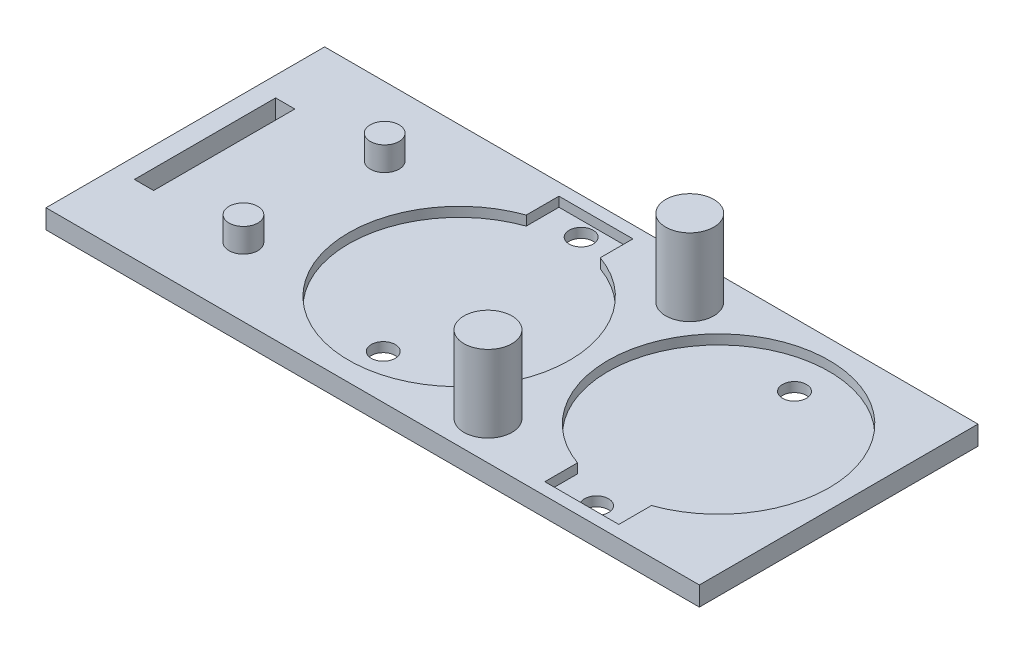
from build123d import *

# Parameters (mm, degrees)
SKETCH1_W             = 68
SKETCH1_H             = 29
BASE_DEPTH            = 2
SKETCH2_R             = 1.5
LEFT_PEG_DEPTH        = 2.5
SKETCH3_R             = 1.5
RIGHT_PEG_DEPTH       = 2.5
SKETCH4_W             = 2
SKETCH4_H             = 14.7
ACCEL_WIRE_HOLE_DEPTH = 2.5
RIGHT_BATTERY_DEPTH   = 1
LEFT_BATTERY_DEPTH    = 1
SKETCH12_R            = 1.25
CUT_EXTRUDE10_DEPTH   = 1.5
SKETCH13_R            = 1.25
CUT_EXTRUDE11_DEPTH   = 1.5
SKETCH14_R            = 2.5
BOSS_EXTRUDE1_DEPTH   = 8


with BuildPart() as part:
    # Sketch1 → base (new body)
    with BuildSketch(Plane(origin=(0, 0, 0), x_dir=(1, 0, 0), z_dir=(0, 1, 0))):
        with Locations((6.444444444, 2.555555556)):
            Rectangle(SKETCH1_W, SKETCH1_H)
    extrude(amount=BASE_DEPTH)

    # Sketch2 → left peg (add)
    with BuildSketch(Plane(origin=(0, 2, 0), x_dir=(1, 0, 0), z_dir=(0, 1, 0))):
        with Locations(Location((-14.155555556, -4.794444444, 0), (0, 0, 270))):
            Circle(SKETCH2_R)
    extrude(amount=LEFT_PEG_DEPTH)

    # Sketch3 → right peg (add)
    with BuildSketch(Plane(origin=(0, 2, 0), x_dir=(1, 0, 0), z_dir=(0, 1, 0))):
        with Locations(Location((-14.155555556, 9.905555556, 0), (0, 0, 270))):
            Circle(SKETCH3_R)
    extrude(amount=RIGHT_PEG_DEPTH)

    # Sketch4 → accel wire hole (cut)
    with BuildSketch(Plane(origin=(0, 2, 0), x_dir=(1, 0, 0), z_dir=(0, 1, 0))):
        with Locations((-24.505555556, 2.555555556)):
            Rectangle(SKETCH4_W, SKETCH4_H)
    extrude(amount=-ACCEL_WIRE_HOLE_DEPTH, mode=Mode.SUBTRACT)

    # Sketch10 → right battery (cut)
    with BuildSketch(Plane(origin=(0, 2, 0), x_dir=(1, 0, 0), z_dir=(0, 1, 0))):
        with BuildLine():
            ThreePointArc((38.444444444, 3.555555556), (20.312137154, 12.950367954), (23.094444444, -7.280841447))
            Line((23.094444444, -7.280841447), (30.794444444, -7.280841447))
            ThreePointArc((30.794444444, -7.280841447), (36.339256843, -3.076751735), (38.444444444, 3.555555556))
        make_face()
        with BuildLine():
            Line((30.794444444, -7.280841447), (23.094444444, -7.280841447))
            ThreePointArc((23.094444444, -7.280841447), (26.944444444, -7.944444444), (30.794444444, -7.280841447))
        make_face()
        with BuildLine():
            ThreePointArc((30.794444444, -7.280841447), (26.944444444, -7.944444444), (23.094444444, -7.280841447))
            Line((23.094444444, -7.280841447), (23.094444444, -10.680841447))
            Line((23.094444444, -10.680841447), (30.794444444, -10.680841447))
            Line((30.794444444, -10.680841447), (30.794444444, -7.280841447))
        make_face()
    extrude(amount=-RIGHT_BATTERY_DEPTH, mode=Mode.SUBTRACT)

    # Sketch11 → left battery (cut)
    with BuildSketch(Plane(origin=(0, 2, 0), x_dir=(1, 0, 0), z_dir=(0, 1, 0))):
        with BuildLine():
            ThreePointArc((5.794444444, 12.391952558), (1.944444444, 13.055555556), (-1.905555556, 12.391952558))
            Line((-1.905555556, 12.391952558), (5.794444444, 12.391952558))
        make_face()
        with BuildLine():
            Line((5.794444444, 12.391952558), (-1.905555556, 12.391952558))
            ThreePointArc((-1.905555556, 12.391952558), (-4.687862846, -7.839256843), (13.444444444, 1.555555556))
            ThreePointArc((13.444444444, 1.555555556), (11.339256843, 8.187862846), (5.794444444, 12.391952558))
        make_face()
        with BuildLine():
            Line((-1.905555556, 15.791952558), (-1.905555556, 12.391952558))
            ThreePointArc((-1.905555556, 12.391952558), (1.944444444, 13.055555556), (5.794444444, 12.391952558))
            Line((5.794444444, 12.391952558), (5.794444444, 15.791952558))
            Line((5.794444444, 15.791952558), (-1.905555556, 15.791952558))
        make_face()
    extrude(amount=-LEFT_BATTERY_DEPTH, mode=Mode.SUBTRACT)

    # Sketch12 → Cut-Extrude10 (cut)
    with BuildSketch(Plane(origin=(0, 1, 0), x_dir=(1, 0, 0), z_dir=(0, 1, 0))):
        with Locations(Location((1.944444444, 14.255555556, 0), (0, 0, 270))):
            Circle(SKETCH12_R)
        with Locations(Location((1.944444444, -6.344444444, 0), (0, 0, 270))):
            Circle(SKETCH12_R)
    extrude(amount=-CUT_EXTRUDE10_DEPTH, mode=Mode.SUBTRACT)

    # Sketch13 → Cut-Extrude11 (cut)
    with BuildSketch(Plane(origin=(0, 1, 0), x_dir=(1, 0, 0), z_dir=(0, 1, 0))):
        with Locations(Location((26.944444444, 11.455555556, 0), (0, 0, 270))):
            Circle(SKETCH13_R)
        with Locations(Location((26.944444444, -9.144444444, 0), (0, 0, 270))):
            Circle(SKETCH13_R)
    extrude(amount=-CUT_EXTRUDE11_DEPTH, mode=Mode.SUBTRACT)

    # Sketch14 → Boss-Extrude1 (add)
    with BuildSketch(Plane(origin=(0, 2, 0), x_dir=(1, 0, 0), z_dir=(0, 1, 0))):
        with Locations(Location((14.444444444, 13.055555556, 0), (0, 0, 270))):
            Circle(SKETCH14_R)
        with Locations(Location((14.444444444, -7.944444444, 0), (0, 0, 270))):
            Circle(SKETCH14_R)
    extrude(amount=BOSS_EXTRUDE1_DEPTH)


solid = part.part
